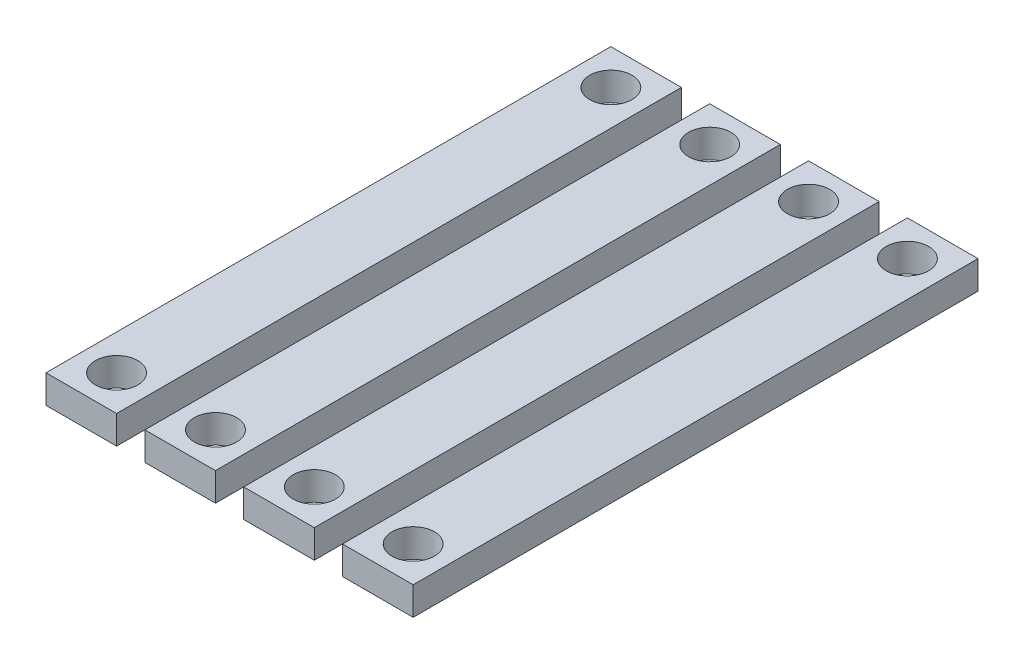
from build123d import *

# Parameters (mm, degrees)
SKETCH_1_W             = 5
SKETCH_1_H             = 40
SKETCH_1_R             = 1.5
EXTRUDE_1_DEPTH        = 2
PATTERN_LINEAR_2_COUNT = 4
PATTERN_LINEAR_2_PITCH = 7


with BuildPart() as part:
    # 草图1 → 凸台-拉伸1 (new body)
    with BuildSketch(Plane(origin=(0, 0, 0), x_dir=(1, 0, 0), z_dir=(0, 1, 0))):
        with Locations((2.5, -20)):
            Rectangle(SKETCH_1_W, SKETCH_1_H)
        with Locations(Location((2.5, -2.5, 0), (0, 0, 270))):
            Circle(SKETCH_1_R, mode=Mode.SUBTRACT)
        with Locations(Location((2.5, -37.5, 0), (0, 0, 270))):
            Circle(SKETCH_1_R, mode=Mode.SUBTRACT)
    extrude(amount=EXTRUDE_1_DEPTH)


with BuildPart() as pattern_linear_2_1:
    # 阵列(线性)2: pattern copy
    add(part.part.moved(Location(Vector(1, 0, 0) * (1 * PATTERN_LINEAR_2_PITCH))))


with BuildPart() as pattern_linear_2_2:
    # 阵列(线性)2: pattern copy
    add(part.part.moved(Location(Vector(1, 0, 0) * (2 * PATTERN_LINEAR_2_PITCH))))


with BuildPart() as pattern_linear_2_3:
    # 阵列(线性)2: pattern copy
    add(part.part.moved(Location(Vector(1, 0, 0) * (3 * PATTERN_LINEAR_2_PITCH))))


solid = Compound([part.part, pattern_linear_2_1.part, pattern_linear_2_2.part, pattern_linear_2_3.part])
